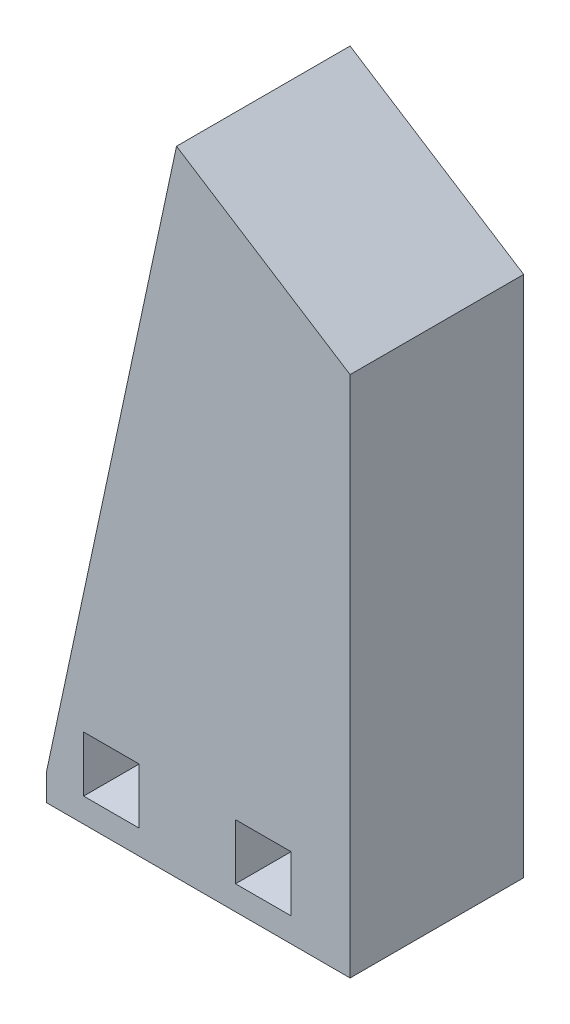
from build123d import *

# Parameters (mm, degrees)
EXTRUDE_1_DEPTH     = 20
EXTRUDE_2_DEPTH     = 20
SKETCH_11_W         = 6.4
SKETCH_11_H         = 6.4
CUT_EXTRUDE_2_DEPTH = 13.1
SKETCH_4_R          = 1.6
CUT_EXTRUDE_1_DEPTH = 9.2


with BuildPart() as part:
    # 草图3 → 凸台-拉伸1 (new body)
    with BuildSketch(Plane.XY):
        Polygon((0, 0), (20, -12.790533612), (20, -72.995577455), (0, -72.995577455), align=None)
    extrude(amount=EXTRUDE_1_DEPTH)

    # 草图6 → 凸台-拉伸2 (add)
    with BuildSketch(Plane.XY.offset(20)):
        Polygon((0, -72.995577455), (-15, -72.995577455), (-15, -69.995577455), (0, 0), (0, -69.995577455), align=None)
    extrude(amount=-EXTRUDE_2_DEPTH)

    # 草图11 → 切除-拉伸2 (cut)
    with BuildSketch(Plane.XY.offset(20)):
        with Locations((-7.5, -66.995577455)):
            Rectangle(SKETCH_11_W, SKETCH_11_H)
        with Locations((10, -66.995577455)):
            Rectangle(SKETCH_11_W, SKETCH_11_H)
    extrude(amount=-CUT_EXTRUDE_2_DEPTH, mode=Mode.SUBTRACT)

    # 草图4 → 切除-拉伸1 (cut)
    with BuildSketch(Plane.XZ.offset(72.995577455)):
        with Locations(Location((10, 10, 0), (0, 0, 270))):
            Circle(SKETCH_4_R)
        with Locations(Location((-7.5, 10, 0), (0, 0, 270))):
            Circle(SKETCH_4_R)
    extrude(amount=-CUT_EXTRUDE_1_DEPTH, mode=Mode.SUBTRACT)


solid = part.part
